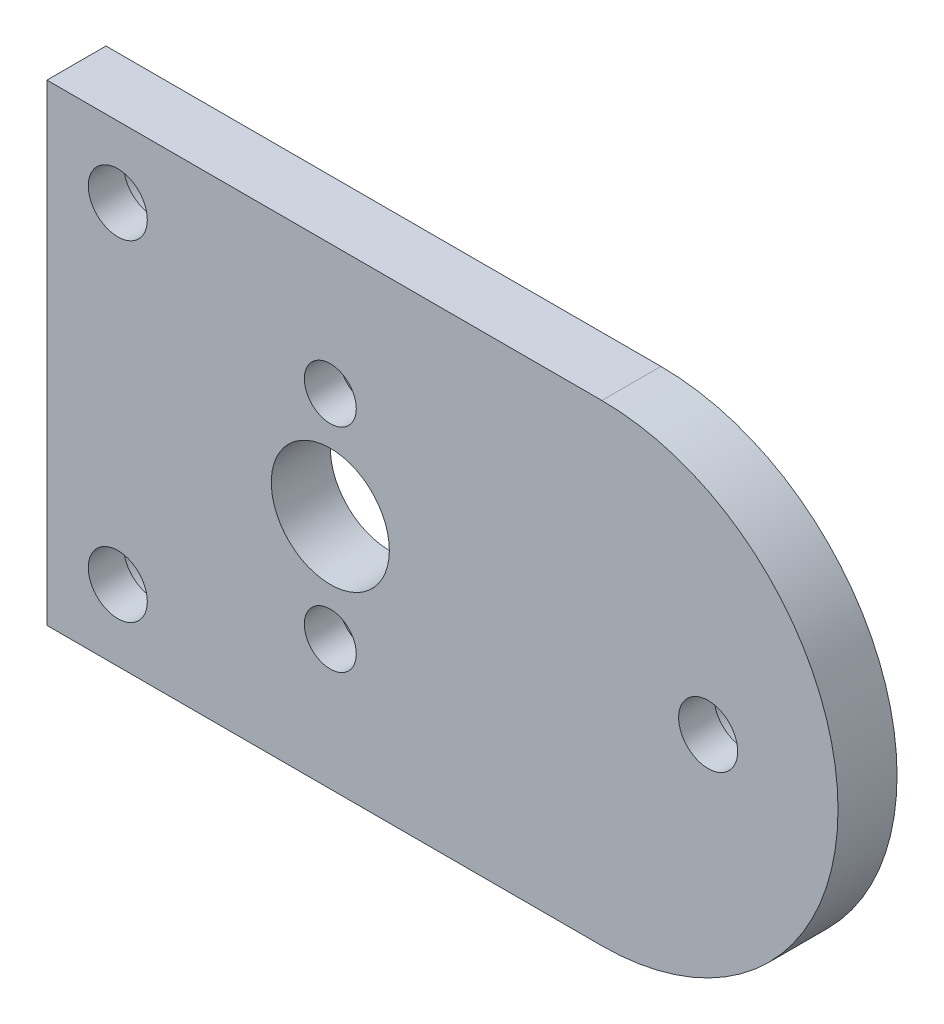
from build123d import *

# Parameters (mm, degrees)
SKETCH_1_R          = 2.5
SKETCH_1_R_2        = 0.85
SKETCH_1_R_3        = 1.25
EXTRUDE_1_DEPTH     = 1.25
CUT_EXTRUDE_START   = 1.25
SKETCH_1_4_R        = 1.1
CUT_EXTRUDE_1_DEPTH = 1.5
CUT_EXTRUDE_START_2 = -1.25
SKETCH_1_5_R        = 2
CUT_EXTRUDE_3_DEPTH = 1


with BuildPart() as part:
    # 草图1 → 凸台-拉伸1 (new, symmetric)
    with BuildSketch(Plane.XY):
        with BuildLine():
            Line((11.5, 10), (-12, 10))
            Line((-12, 10), (-12, -10))
            Line((-12, -10), (11.5, -10))
            ThreePointArc((11.5, -10), (21.5, 0), (11.5, 10))
        make_face()
        Circle(SKETCH_1_R, mode=Mode.SUBTRACT)
        with Locations((0, 4.5)):
            Circle(SKETCH_1_R_2, mode=Mode.SUBTRACT)
        with Locations((0, -4.5)):
            Circle(SKETCH_1_R_2, mode=Mode.SUBTRACT)
        with Locations((-9, 7)):
            Circle(SKETCH_1_R_3, mode=Mode.SUBTRACT)
        with Locations((-9, -7)):
            Circle(SKETCH_1_R_3, mode=Mode.SUBTRACT)
        with Locations((16, 0)):
            Circle(SKETCH_1_R_3, mode=Mode.SUBTRACT)
    extrude(amount=EXTRUDE_1_DEPTH, both=True)

    # 草图1<4> → 切除-拉伸1 (cut)
    with BuildSketch(Plane.XY.offset(CUT_EXTRUDE_START)):
        with Locations((0, 4.5)):
            Circle(SKETCH_1_4_R)
        with Locations((0, -4.5)):
            Circle(SKETCH_1_4_R)
    extrude(amount=-CUT_EXTRUDE_1_DEPTH, mode=Mode.SUBTRACT)

    # 草图1<5> → 切除-拉伸3 (cut)
    with BuildSketch(Plane.XY.offset(CUT_EXTRUDE_START_2)):
        with Locations((-9, 7)):
            Circle(SKETCH_1_5_R)
        with Locations((-9, -7)):
            Circle(SKETCH_1_5_R)
        with Locations((16, 0)):
            Circle(SKETCH_1_5_R)
    extrude(amount=CUT_EXTRUDE_3_DEPTH, mode=Mode.SUBTRACT)


solid = part.part
